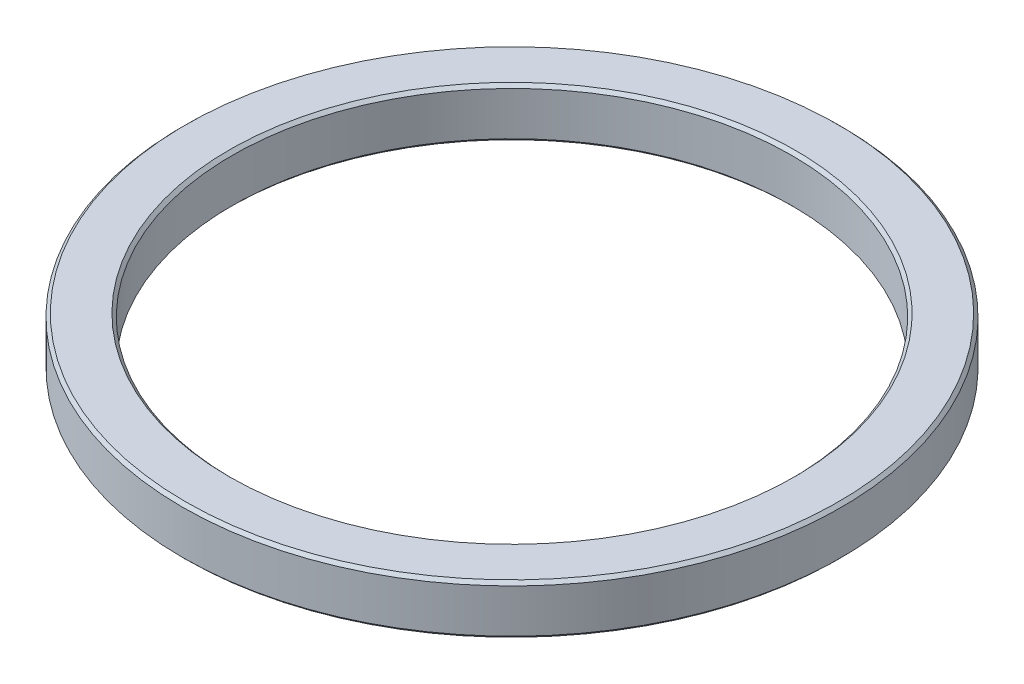
from build123d import *

# Parameters (mm, degrees)
SKETCH_1_R      = 53
SKETCH_1_R_2    = 45
EXTRUDE_1_DEPTH = 4
CHAMFER_1_SIZE  = 0.5


with BuildPart() as part:
    # 草图1 → 凸台-拉伸1 (new, symmetric)
    with BuildSketch(Plane(origin=(0, 0, 0), x_dir=(1, 0, 0), z_dir=(0, 1, 0))):
        with Locations(Location((0, 0, 0), (0, 0, 270))):
            Circle(SKETCH_1_R)
        with Locations(Location((0, 0, 0), (0, 0, 270))):
            Circle(SKETCH_1_R_2, mode=Mode.SUBTRACT)
    extrude(amount=EXTRUDE_1_DEPTH, both=True)

    # 倒角1
    chamfer_1_edges = [part.edges().sort_by_distance(p)[0] for p in [
        (0, -4, -53),
        (0, 4, -53),
        (0, -4, -45),
        (0, 4, -45),
    ]]
    chamfer(chamfer_1_edges, length=CHAMFER_1_SIZE)


solid = part.part
